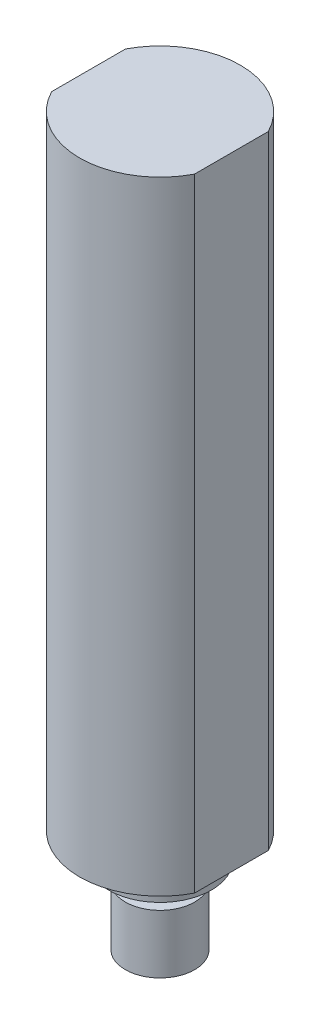
from build123d import *

# Parameters (mm, degrees)
CUT_EXTRUDE1_DEPTH = 101.2883226


with BuildPart() as part:
    # Sketch1 → Revolve1 (revolve)
    with BuildSketch(Plane.XY, mode=Mode.PRIVATE) as revolve1_sk:
        Polygon((0, 0), (4.74, 0), (4.74, 8), (1, 8), (1, 10.53), (7, 10.53), (7, 14.08), (10.975, 14.08), (10.975, 99.08), (0, 99.08), align=None)
    revolve(revolve1_sk.sketch.rotate(Axis((0, 72.454564891, 0), (0, -1, 0)), 90), axis=Axis((0, 72.454564891, 0), (0, -1, 0)))

    # Sketch2 → Cut-Extrude1 (cut, through all)
    with BuildSketch(Plane(origin=(0, 99.08, 0), x_dir=(1, 0, 0), z_dir=(0, 1, 0))):
        with BuildLine():
            Line((-9.75, 5.038663017), (-9.75, -5.038663017))
            ThreePointArc((-9.75, -5.038663017), (-10.975, 0), (-9.75, 5.038663017))
        make_face()
        with BuildLine():
            Line((9.75, -5.038663017), (9.75, 5.038663017))
            ThreePointArc((9.75, 5.038663017), (10.975, 0), (9.75, -5.038663017))
        make_face()
    extrude(amount=-CUT_EXTRUDE1_DEPTH, mode=Mode.SUBTRACT)


solid = part.part
